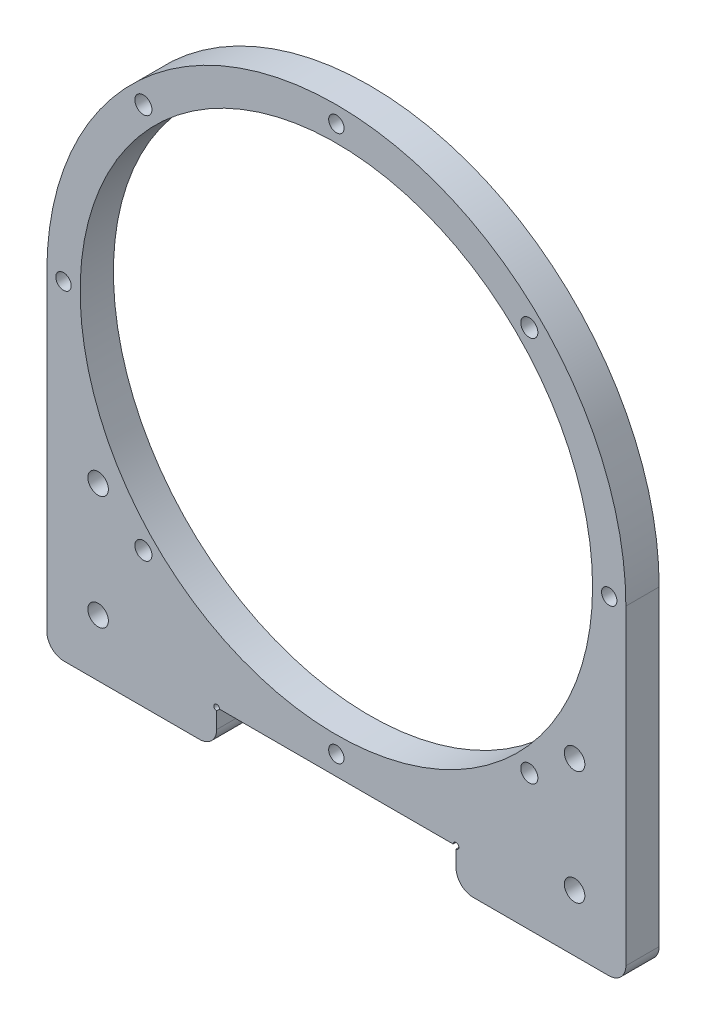
from build123d import *

# Parameters (mm, degrees)
SKETCH1_R           = 1.8
SKETCH1_R_2         = 44.958
SKETCH1_R_3         = 1.35
SKETCH1_R_4         = 1.5
BOSS_EXTRUDE1_DEPTH = 5.842
SKETCH2_W           = 42
SKETCH2_H           = 6.35
CUT_EXTRUDE1_DEPTH  = 78.066295668
SKETCH3_R           = 0.5
CUT_EXTRUDE2_DEPTH  = 78.066295668
FILLET1_R           = 3


with BuildPart() as part:
    # Sketch1 → Boss-Extrude1 (new body)
    with BuildSketch(Plane.XY):
        with BuildLine():
            Line((-50.8, 0), (-50.8, -57.658))
            Line((-50.8, -57.658), (50.8, -57.658))
            Line((50.8, -57.658), (50.8, 0))
            ThreePointArc((50.8, 0), (0, 50.8), (-50.8, 0))
        make_face()
        with Locations((41.8, -47.658)):
            Circle(SKETCH1_R, mode=Mode.SUBTRACT)
        Circle(SKETCH1_R_2, mode=Mode.SUBTRACT)
        with Locations((-47.879, 0)):
            Circle(SKETCH1_R_3, mode=Mode.SUBTRACT)
        with Locations((0, 47.879)):
            Circle(SKETCH1_R_3, mode=Mode.SUBTRACT)
        with Locations((41.8, -27.658)):
            Circle(SKETCH1_R, mode=Mode.SUBTRACT)
        with Locations((47.879, 0)):
            Circle(SKETCH1_R_3, mode=Mode.SUBTRACT)
        with Locations((0, -47.879)):
            Circle(SKETCH1_R_3, mode=Mode.SUBTRACT)
        with Locations((-41.8, -27.658)):
            Circle(SKETCH1_R, mode=Mode.SUBTRACT)
        with Locations((-33.855565576, 33.855565576)):
            Circle(SKETCH1_R_4, mode=Mode.SUBTRACT)
        with Locations((33.855565576, 33.855565576)):
            Circle(SKETCH1_R_4, mode=Mode.SUBTRACT)
        with Locations((33.855565576, -33.855565576)):
            Circle(SKETCH1_R_4, mode=Mode.SUBTRACT)
        with Locations((-33.855565576, -33.855565576)):
            Circle(SKETCH1_R_4, mode=Mode.SUBTRACT)
        with Locations((-41.8, -47.658)):
            Circle(SKETCH1_R, mode=Mode.SUBTRACT)
    extrude(amount=BOSS_EXTRUDE1_DEPTH)

    # Sketch2 → Cut-Extrude1 (cut, through all)
    with BuildSketch(Plane.XY.offset(5.842)):
        with Locations((0, -54.483)):
            Rectangle(SKETCH2_W, SKETCH2_H)
    extrude(amount=-CUT_EXTRUDE1_DEPTH, mode=Mode.SUBTRACT)

    # Sketch3 → Cut-Extrude2 (cut, through all)
    with BuildSketch(Plane.XY.offset(5.842)):
        with Locations((-21, -51.308)):
            Circle(SKETCH3_R)
        with Locations((21, -51.308)):
            Circle(SKETCH3_R)
    extrude(amount=-CUT_EXTRUDE2_DEPTH, mode=Mode.SUBTRACT)

    # Fillet1
    fillet1_edges = [part.edges().sort_by_distance(p)[0] for p in [
        (50.8, -57.658, 2.921),
        (-50.8, -57.658, 2.921),
        (-21, -57.658, 2.921),
        (21, -57.658, 2.921),
    ]]
    fillet(fillet1_edges, radius=FILLET1_R)


solid = part.part
